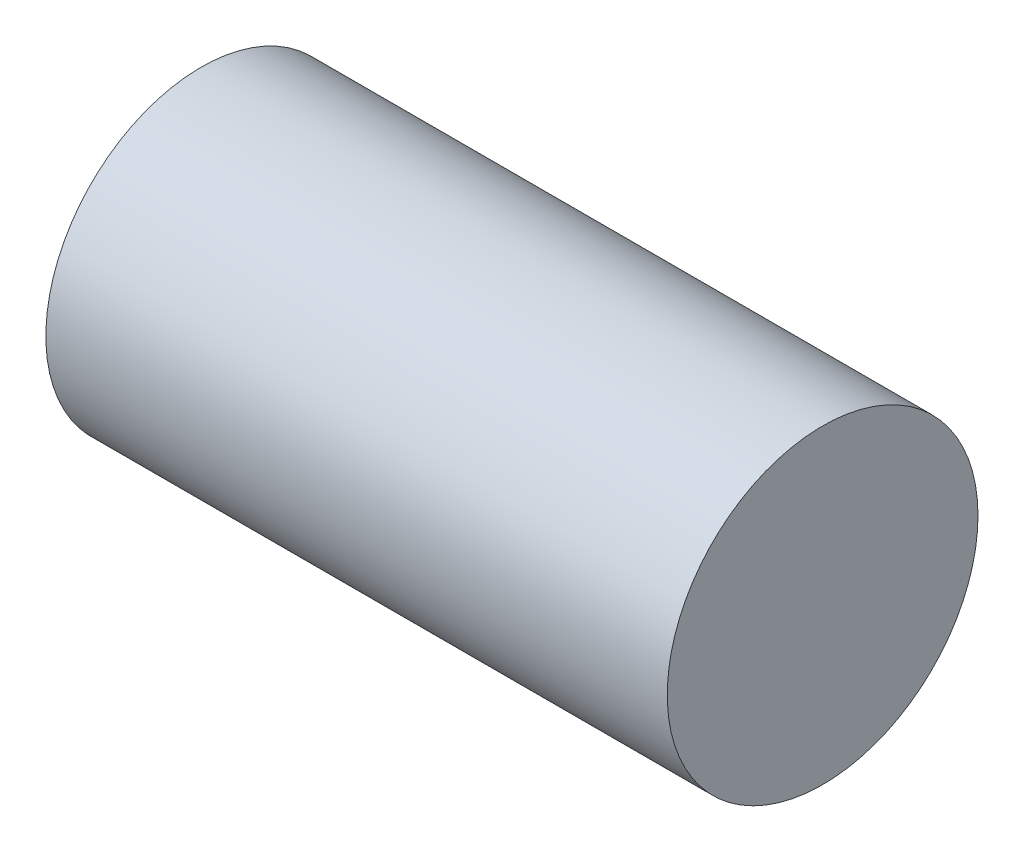
from build123d import *

# Parameters (mm, degrees)
SKIZZE2_R                       = 100
AUFSATZ_LINEAR_AUSTRAGEN1_DEPTH = 400


with BuildPart() as part:
    # Skizze2 → Aufsatz-Linear austragen1 (new body)
    with BuildSketch(Plane(origin=(0, 0, 0), x_dir=(0, 0, -1), z_dir=(1, 0, 0))):
        Circle(SKIZZE2_R)
    extrude(amount=AUFSATZ_LINEAR_AUSTRAGEN1_DEPTH)


solid = part.part
